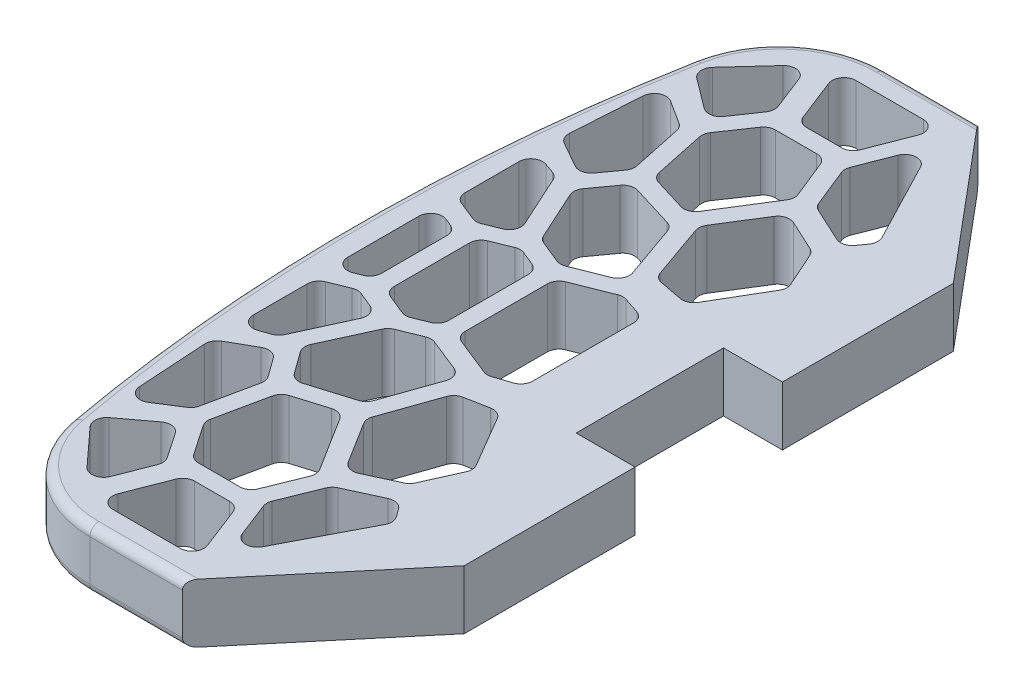
from build123d import *

# Parameters (mm, degrees)
BOSS_EXTRUDE1_DEPTH = 10
FILLET1_R           = 3


with BuildPart() as part:
    # Sketch1 → Boss-Extrude1 (new, symmetric)
    with BuildSketch(Plane(origin=(0, 0, 0), x_dir=(1, 0, 0), z_dir=(0, 1, 0))):
        with BuildLine():
            Line((0, 83), (-43.633180821, 135))
            Line((-43.633180821, 135), (-75, 135))
            ThreePointArc((-75, 135), (-98.046638388, 126.655966066), (-110.409836066, 105.491803279))
            ThreePointArc((-110.409836066, 105.491803279), (-120, 0), (-110.409836066, -105.491803279))
            ThreePointArc((-110.409836066, -105.491803279), (-98.046638388, -126.655966066), (-75, -135))
            Line((-75, -135), (-43.633180821, -135))
            Line((-43.633180821, -135), (0, -83))
            Line((0, -83), (0, -25))
            Line((0, -25), (-20, -25))
            Line((-20, -25), (-20, 25))
            Line((-20, 25), (0, 25))
            Line((0, 25), (0, 83))
        make_face()
        with BuildLine():
            Line((-51.583510871, -99.551891667), (-47.043977303, -111.24493966))
            ThreePointArc((-47.043977303, -111.24493966), (-43.53404012, -113.791310112), (-39.766825217, -111.643810779))
            Line((-39.766825217, -111.643810779), (-25.557952149, -84.3396352))
            ThreePointArc((-25.557952149, -84.3396352), (-25.116544676, -82.206333495), (-25.858537821, -80.158099404))
            Line((-25.858537821, -80.158099404), (-27.793296277, -77.467111323))
            ThreePointArc((-27.793296277, -77.467111323), (-30.01966596, -75.934731591), (-32.712336522, -76.168044361))
            Line((-32.712336522, -76.168044361), (-44.289692518, -81.492492205))
            ThreePointArc((-44.289692518, -81.492492205), (-45.513232816, -82.366202314), (-46.327796918, -83.629889594))
            Line((-46.327796918, -83.629889594), (-51.564089102, -96.607557417))
            ThreePointArc((-51.564089102, -96.607557417), (-51.854569543, -98.077872496), (-51.583510871, -99.551891667))
        make_face(mode=Mode.SUBTRACT)
        with BuildLine():
            Line((-76.169198798, -126.067380558), (-53.243197888, -126.067380558))
            ThreePointArc((-53.243197888, -126.067380558), (-49.942399661, -124.326745749), (-49.51434358, -120.619746091))
            Line((-49.51434358, -120.619746091), (-55.022930664, -106.430584985))
            ThreePointArc((-55.022930664, -106.430584985), (-56.492419781, -104.577421226), (-58.751784972, -103.878219453))
            Line((-58.751784972, -103.878219453), (-70.633478788, -103.878219453))
            ThreePointArc((-70.633478788, -103.878219453), (-72.890102388, -104.575546304), (-74.359923873, -106.424394489))
            Line((-74.359923873, -106.424394489), (-79.895643883, -120.613555595))
            ThreePointArc((-79.895643883, -120.613555595), (-79.471871946, -124.324004158), (-76.169198798, -126.067380558))
        make_face(mode=Mode.SUBTRACT)
        with BuildLine():
            Line((-104.314416206, -105.622682832), (-92.903661411, -118.071048963))
            ThreePointArc((-92.903661411, -118.071048963), (-89.219305628, -119.29994155), (-86.228570564, -116.822007268))
            Line((-86.228570564, -116.822007268), (-81.731391874, -105.294835944))
            ThreePointArc((-81.731391874, -105.294835944), (-81.483446176, -103.389106237), (-82.152909795, -101.58768978))
            Line((-82.152909795, -101.58768978), (-87.95611023, -93.07618474))
            ThreePointArc((-87.95611023, -93.07618474), (-90.607698285, -91.383223133), (-93.663418974, -92.131293511))
            Line((-93.663418974, -92.131293511), (-103.768152023, -99.721603743))
            ThreePointArc((-103.768152023, -99.721603743), (-105.348741321, -102.551111688), (-104.314416206, -105.622682832))
        make_face(mode=Mode.SUBTRACT)
        with BuildLine():
            Line((-110.409836066, -12.05611111), (-110.409836066, 12.05611111))
            ThreePointArc((-110.409836066, 12.05611111), (-108.643074701, 15.374641688), (-104.903513467, 15.76164646))
            Line((-104.903513467, 15.76164646), (-102.447325525, 14.763191161))
            ThreePointArc((-102.447325525, 14.763191161), (-100.635117546, 13.290894447), (-99.953648124, 11.057655812))
            Line((-99.953648124, 11.057655812), (-99.953648124, -11.057655812))
            ThreePointArc((-99.953648124, -11.057655812), (-100.635117546, -13.290894447), (-102.447325525, -14.763191161))
            Line((-102.447325525, -14.763191161), (-104.903513467, -15.76164646))
            ThreePointArc((-104.903513467, -15.76164646), (-108.643074701, -15.374641688), (-110.409836066, -12.05611111))
        make_face(mode=Mode.SUBTRACT)
        with BuildLine():
            Line((-91.459970723, 16.461636395), (-84.931076073, 19.115671678))
            ThreePointArc((-84.931076073, 19.115671678), (-83.424753474, 19.410136328), (-81.918430875, 19.115671678))
            Line((-81.918430875, 19.115671678), (-77.203913224, 17.199191652))
            ThreePointArc((-77.203913224, 17.199191652), (-75.391705245, 15.726894938), (-74.710235823, 13.493656303))
            Line((-74.710235823, 13.493656303), (-74.710235823, -13.493656303))
            ThreePointArc((-74.710235823, -13.493656303), (-75.391705245, -15.726894938), (-77.203913224, -17.199191652))
            Line((-77.203913224, -17.199191652), (-81.918430875, -19.115671678))
            ThreePointArc((-81.918430875, -19.115671678), (-83.424753474, -19.410136328), (-84.931076073, -19.115671678))
            Line((-84.931076073, -19.115671678), (-91.459970723, -16.461636395))
            ThreePointArc((-91.459970723, -16.461636395), (-93.272178702, -14.989339681), (-93.953648124, -12.756101046))
            Line((-93.953648124, -12.756101046), (-93.953648124, 12.756101046))
            ThreePointArc((-93.953648124, 12.756101046), (-93.272178702, 14.989339681), (-91.459970723, 16.461636395))
        make_face(mode=Mode.SUBTRACT)
        with BuildLine():
            Line((-68.710235823, -13.938814796), (-68.710235823, 13.938814796))
            ThreePointArc((-68.710235823, 13.938814796), (-68.021647467, 16.18259574), (-66.192959361, 17.653855968))
            Line((-66.192959361, 17.653855968), (-53.597435718, 22.68090103))
            ThreePointArc((-53.597435718, 22.68090103), (-52.231300048, 22.964160406), (-50.850980279, 22.760985901))
            Line((-50.850980279, 22.760985901), (-45.35232675, 20.929999578))
            ThreePointArc((-45.35232675, 20.929999578), (-43.371453313, 19.474218785), (-42.616058651, 17.134873535))
            Line((-42.616058651, 17.134873535), (-42.616058651, -17.134873535))
            ThreePointArc((-42.616058651, -17.134873535), (-43.371453313, -19.474218785), (-45.35232675, -20.929999578))
            Line((-45.35232675, -20.929999578), (-50.850980279, -22.760985901))
            ThreePointArc((-50.850980279, -22.760985901), (-52.231300048, -22.964160406), (-53.597435718, -22.68090103))
            Line((-53.597435718, -22.68090103), (-66.192959361, -17.653855968))
            ThreePointArc((-66.192959361, -17.653855968), (-68.021647467, -16.18259574), (-68.710235823, -13.938814796))
        make_face(mode=Mode.SUBTRACT)
        with BuildLine():
            Line((-109.467200853, -45.084990895), (-109.467200853, -26.785450362))
            ThreePointArc((-109.467200853, -26.785450362), (-108.785731431, -24.552211727), (-106.973523452, -23.079915013))
            Line((-106.973523452, -23.079915013), (-100.549048075, -20.468326798))
            ThreePointArc((-100.549048075, -20.468326798), (-99.042725476, -20.173862148), (-97.536402877, -20.468326798))
            Line((-97.536402877, -20.468326798), (-92.429437297, -22.544339288))
            ThreePointArc((-92.429437297, -22.544339288), (-90.218255908, -24.773336762), (-90.297464245, -27.912043328))
            Line((-90.297464245, -27.912043328), (-98.337911629, -45.511655757))
            ThreePointArc((-98.337911629, -45.511655757), (-99.275493757, -46.800105046), (-100.641672676, -47.620298304))
            Line((-100.641672676, -47.620298304), (-104.132666249, -48.855802133))
            ThreePointArc((-104.132666249, -48.855802133), (-107.776081705, -48.351345011), (-109.467200853, -45.084990895))
        make_face(mode=Mode.SUBTRACT)
        with BuildLine():
            Line((-91.028243615, -43.950602801), (-83.466307585, -27.398396567))
            ThreePointArc((-83.466307585, -27.398396567), (-82.595792825, -26.17276524), (-81.334334533, -25.355029908))
            Line((-81.334334533, -25.355029908), (-73.785358558, -22.286325378))
            ThreePointArc((-73.785358558, -22.286325378), (-72.291756772, -21.991880956), (-70.796312421, -22.276819556))
            Line((-70.796312421, -22.276819556), (-59.788001344, -26.670386462))
            ThreePointArc((-59.788001344, -26.670386462), (-57.628848621, -28.731118927), (-57.497437693, -31.71294554))
            Line((-57.497437693, -31.71294554), (-63.878784021, -49.851045401))
            ThreePointArc((-63.878784021, -49.851045401), (-64.88305062, -51.410138826), (-66.482539605, -52.348732827))
            Line((-66.482539605, -52.348732827), (-80.925996583, -56.764725681))
            ThreePointArc((-80.925996583, -56.764725681), (-83.369608001, -56.731184975), (-85.337640324, -55.282319721))
            Line((-85.337640324, -55.282319721), (-90.632060101, -47.955570863))
            ThreePointArc((-90.632060101, -47.955570863), (-91.370518919, -46.006541571), (-91.028243615, -43.950602801))
        make_face(mode=Mode.SUBTRACT)
        with BuildLine():
            Line((-109.185897217, -61.87312516), (-107.716713798, -85.45480826))
            ThreePointArc((-107.716713798, -85.45480826), (-105.538804361, -88.770929923), (-101.57603347, -88.580143981))
            Line((-101.57603347, -88.580143981), (-93.567892012, -83.480989595))
            ThreePointArc((-93.567892012, -83.480989595), (-92.427915772, -82.384305249), (-91.802216554, -80.931458777))
            Line((-91.802216554, -80.931458777), (-88.195310047, -63.809248772))
            ThreePointArc((-88.195310047, -63.809248772), (-88.196501553, -62.154552316), (-88.867294221, -60.641919189))
            Line((-88.867294221, -60.641919189), (-93.373030139, -54.406600328))
            ThreePointArc((-93.373030139, -54.406600328), (-95.765108561, -52.840762765), (-98.591441924, -53.271722356))
            Line((-98.591441924, -53.271722356), (-107.16993739, -58.146722508))
            ThreePointArc((-107.16993739, -58.146722508), (-108.711796874, -59.721098426), (-109.185897217, -61.87312516))
        make_face(mode=Mode.SUBTRACT)
        with BuildLine():
            Line((-59.251697806, -54.778040986), (-52.741129763, -36.27264616))
            ThreePointArc((-52.741129763, -36.27264616), (-51.5738241, -34.565553665), (-49.709944902, -33.669606327))
            Line((-49.709944902, -33.669606327), (-41.851396628, -32.185886366))
            ThreePointArc((-41.851396628, -32.185886366), (-39.453295699, -32.475335944), (-37.659082514, -34.092576856))
            Line((-37.659082514, -34.092576856), (-27.485532771, -51.436056894))
            ThreePointArc((-27.485532771, -51.436056894), (-26.941717734, -53.241406998), (-27.28533147, -55.095309205))
            Line((-27.28533147, -55.095309205), (-32.572892381, -66.897900524))
            ThreePointArc((-32.572892381, -66.897900524), (-33.377285177, -68.073239302), (-34.542494472, -68.892236442))
            Line((-34.542494472, -68.892236442), (-45.017913038, -73.743077262))
            ThreePointArc((-45.017913038, -73.743077262), (-47.837272018, -73.947897777), (-50.088016189, -72.237667624))
            Line((-50.088016189, -72.237667624), (-58.867702773, -58.229870235))
            ThreePointArc((-58.867702773, -58.229870235), (-59.45388757, -56.547806551), (-59.251697806, -54.778040986))
        make_face(mode=Mode.SUBTRACT)
        with BuildLine():
            Line((-86.098877878, -82.964838643), (-82.455180266, -65.66797897))
            ThreePointArc((-82.455180266, -65.66797897), (-81.492665055, -63.792848275), (-79.71061556, -62.667303851))
            Line((-79.71061556, -62.667303851), (-68.758995788, -59.318917468))
            ThreePointArc((-68.758995788, -59.318917468), (-66.191217311, -59.396469443), (-64.200172027, -61.019811457))
            Line((-64.200172027, -61.019811457), (-52.796960318, -79.213385644))
            ThreePointArc((-52.796960318, -79.213385644), (-52.201794736, -80.985423607), (-52.476819935, -82.834396769))
            Line((-52.476819935, -82.834396769), (-57.536730596, -95.374919235))
            ThreePointArc((-57.536730596, -95.374919235), (-59.008619742, -97.193849041), (-61.246163135, -97.878219453))
            Line((-61.246163135, -97.878219453), (-75.306136497, -97.878219453))
            ThreePointArc((-75.306136497, -97.878219453), (-77.175189091, -97.414692611), (-78.611063662, -96.131540654))
            Line((-78.611063662, -96.131540654), (-85.489708732, -86.042690057))
            ThreePointArc((-85.489708732, -86.042690057), (-86.108665781, -84.565985031), (-86.098877878, -82.964838643))
        make_face(mode=Mode.SUBTRACT)
        with BuildLine():
            Line((-27.793296277, 77.467111323), (-25.858537821, 80.158099404))
            ThreePointArc((-25.858537821, 80.158099404), (-25.116544676, 82.206333495), (-25.557952149, 84.3396352))
            Line((-25.557952149, 84.3396352), (-39.766825217, 111.643810779))
            ThreePointArc((-39.766825217, 111.643810779), (-43.53404012, 113.791310112), (-47.043977303, 111.24493966))
            Line((-47.043977303, 111.24493966), (-51.583510871, 99.551891667))
            ThreePointArc((-51.583510871, 99.551891667), (-51.854569543, 98.077872496), (-51.564089102, 96.607557417))
            Line((-51.564089102, 96.607557417), (-46.327796918, 83.629889594))
            ThreePointArc((-46.327796918, 83.629889594), (-45.513232816, 82.366202314), (-44.289692518, 81.492492205))
            Line((-44.289692518, 81.492492205), (-32.712336522, 76.168044361))
            ThreePointArc((-32.712336522, 76.168044361), (-30.01966596, 75.934731591), (-27.793296277, 77.467111323))
        make_face(mode=Mode.SUBTRACT)
        with BuildLine():
            Line((-78.611063662, 96.131540654), (-85.489708732, 86.042690057))
            ThreePointArc((-85.489708732, 86.042690057), (-86.108665781, 84.565985031), (-86.098877878, 82.964838643))
            Line((-86.098877878, 82.964838643), (-82.455180266, 65.66797897))
            ThreePointArc((-82.455180266, 65.66797897), (-81.492665055, 63.792848275), (-79.71061556, 62.667303851))
            Line((-79.71061556, 62.667303851), (-68.758995788, 59.318917468))
            ThreePointArc((-68.758995788, 59.318917468), (-66.191217311, 59.396469443), (-64.200172027, 61.019811457))
            Line((-64.200172027, 61.019811457), (-52.796960318, 79.213385644))
            ThreePointArc((-52.796960318, 79.213385644), (-52.201794736, 80.985423607), (-52.476819935, 82.834396769))
            Line((-52.476819935, 82.834396769), (-57.536730596, 95.374919235))
            ThreePointArc((-57.536730596, 95.374919235), (-59.008619742, 97.193849041), (-61.246163135, 97.878219453))
            Line((-61.246163135, 97.878219453), (-75.306136497, 97.878219453))
            ThreePointArc((-75.306136497, 97.878219453), (-77.175189091, 97.414692611), (-78.611063662, 96.131540654))
        make_face(mode=Mode.SUBTRACT)
        with BuildLine():
            Line((-50.088016189, 72.237667624), (-58.867702773, 58.229870235))
            ThreePointArc((-58.867702773, 58.229870235), (-59.45388757, 56.547806551), (-59.251697806, 54.778040986))
            Line((-59.251697806, 54.778040986), (-52.741129763, 36.27264616))
            ThreePointArc((-52.741129763, 36.27264616), (-51.5738241, 34.565553665), (-49.709944902, 33.669606327))
            Line((-49.709944902, 33.669606327), (-41.851396628, 32.185886366))
            ThreePointArc((-41.851396628, 32.185886366), (-39.453295699, 32.475335944), (-37.659082514, 34.092576856))
            Line((-37.659082514, 34.092576856), (-27.485532771, 51.436056894))
            ThreePointArc((-27.485532771, 51.436056894), (-26.941717734, 53.241406998), (-27.28533147, 55.095309205))
            Line((-27.28533147, 55.095309205), (-32.572892381, 66.897900524))
            ThreePointArc((-32.572892381, 66.897900524), (-33.377285177, 68.073239302), (-34.542494472, 68.892236442))
            Line((-34.542494472, 68.892236442), (-45.017913038, 73.743077262))
            ThreePointArc((-45.017913038, 73.743077262), (-47.837272018, 73.947897777), (-50.088016189, 72.237667624))
        make_face(mode=Mode.SUBTRACT)
        with BuildLine():
            Line((-98.591441924, 53.271722356), (-107.16993739, 58.146722508))
            ThreePointArc((-107.16993739, 58.146722508), (-108.711796874, 59.721098426), (-109.185897217, 61.87312516))
            Line((-109.185897217, 61.87312516), (-107.716713798, 85.45480826))
            ThreePointArc((-107.716713798, 85.45480826), (-105.538804361, 88.770929923), (-101.57603347, 88.580143981))
            Line((-101.57603347, 88.580143981), (-93.567892012, 83.480989595))
            ThreePointArc((-93.567892012, 83.480989595), (-92.427915772, 82.384305249), (-91.802216554, 80.931458777))
            Line((-91.802216554, 80.931458777), (-88.195310047, 63.809248772))
            ThreePointArc((-88.195310047, 63.809248772), (-88.196501553, 62.154552316), (-88.867294221, 60.641919189))
            Line((-88.867294221, 60.641919189), (-93.373030139, 54.406600328))
            ThreePointArc((-93.373030139, 54.406600328), (-95.765108561, 52.840762765), (-98.591441924, 53.271722356))
        make_face(mode=Mode.SUBTRACT)
        with BuildLine():
            Line((-85.337640324, 55.282319721), (-90.632060101, 47.955570863))
            ThreePointArc((-90.632060101, 47.955570863), (-91.370518919, 46.006541571), (-91.028243615, 43.950602801))
            Line((-91.028243615, 43.950602801), (-83.466307585, 27.398396567))
            ThreePointArc((-83.466307585, 27.398396567), (-82.595792825, 26.17276524), (-81.334334533, 25.355029908))
            Line((-81.334334533, 25.355029908), (-73.785358558, 22.286325378))
            ThreePointArc((-73.785358558, 22.286325378), (-72.291756772, 21.991880956), (-70.796312421, 22.276819556))
            Line((-70.796312421, 22.276819556), (-59.788001344, 26.670386462))
            ThreePointArc((-59.788001344, 26.670386462), (-57.628848621, 28.731118927), (-57.497437693, 31.71294554))
            Line((-57.497437693, 31.71294554), (-63.878784021, 49.851045401))
            ThreePointArc((-63.878784021, 49.851045401), (-64.88305062, 51.410138826), (-66.482539605, 52.348732827))
            Line((-66.482539605, 52.348732827), (-80.925996583, 56.764725681))
            ThreePointArc((-80.925996583, 56.764725681), (-83.369608001, 56.731184975), (-85.337640324, 55.282319721))
        make_face(mode=Mode.SUBTRACT)
        with BuildLine():
            Line((-100.641672676, 47.620298304), (-104.132666249, 48.855802133))
            ThreePointArc((-104.132666249, 48.855802133), (-107.776081705, 48.351345011), (-109.467200853, 45.084990895))
            Line((-109.467200853, 45.084990895), (-109.467200853, 26.785450362))
            ThreePointArc((-109.467200853, 26.785450362), (-108.785731431, 24.552211727), (-106.973523452, 23.079915013))
            Line((-106.973523452, 23.079915013), (-100.549048075, 20.468326798))
            ThreePointArc((-100.549048075, 20.468326798), (-99.042725476, 20.173862148), (-97.536402877, 20.468326798))
            Line((-97.536402877, 20.468326798), (-92.429437297, 22.544339288))
            ThreePointArc((-92.429437297, 22.544339288), (-90.218255908, 24.773336762), (-90.297464245, 27.912043328))
            Line((-90.297464245, 27.912043328), (-98.337911629, 45.511655757))
            ThreePointArc((-98.337911629, 45.511655757), (-99.275493757, 46.800105046), (-100.641672676, 47.620298304))
        make_face(mode=Mode.SUBTRACT)
        with BuildLine():
            Line((-93.663418974, 92.131293511), (-103.768152023, 99.721603743))
            ThreePointArc((-103.768152023, 99.721603743), (-105.348741321, 102.551111688), (-104.314416206, 105.622682832))
            Line((-104.314416206, 105.622682832), (-92.903661411, 118.071048963))
            ThreePointArc((-92.903661411, 118.071048963), (-89.219305628, 119.29994155), (-86.228570564, 116.822007268))
            Line((-86.228570564, 116.822007268), (-81.731391874, 105.294835944))
            ThreePointArc((-81.731391874, 105.294835944), (-81.483446176, 103.389106237), (-82.152909795, 101.58768978))
            Line((-82.152909795, 101.58768978), (-87.95611023, 93.07618474))
            ThreePointArc((-87.95611023, 93.07618474), (-90.607698285, 91.383223133), (-93.663418974, 92.131293511))
        make_face(mode=Mode.SUBTRACT)
        with BuildLine():
            Line((-74.359923873, 106.424394489), (-79.895643883, 120.613555595))
            ThreePointArc((-79.895643883, 120.613555595), (-79.471871946, 124.324004158), (-76.169198798, 126.067380558))
            Line((-76.169198798, 126.067380558), (-53.243197888, 126.067380558))
            ThreePointArc((-53.243197888, 126.067380558), (-49.942399661, 124.326745749), (-49.51434358, 120.619746091))
            Line((-49.51434358, 120.619746091), (-55.022930664, 106.430584985))
            ThreePointArc((-55.022930664, 106.430584985), (-56.492419781, 104.577421226), (-58.751784972, 103.878219453))
            Line((-58.751784972, 103.878219453), (-70.633478788, 103.878219453))
            ThreePointArc((-70.633478788, 103.878219453), (-72.890102388, 104.575546304), (-74.359923873, 106.424394489))
        make_face(mode=Mode.SUBTRACT)
    extrude(amount=BOSS_EXTRUDE1_DEPTH, both=True)

    # Fillet1
    fillet1_edges = [part.edges().sort_by_distance(p)[0] for p in [
        (-120, -10, 0),
        (-98.046638388, -10, -126.655966066),
        (-59.316590411, -10, -135),
        (-59.316590411, -10, 135),
        (-98.046638388, -10, 126.655966066),
        (-98.046638388, 10, 126.655966066),
        (-59.316590411, 10, 135),
        (-59.316590411, 10, -135),
        (-98.046638388, 10, -126.655966066),
        (-120, 10, 0),
    ]]
    fillet(fillet1_edges, radius=FILLET1_R)


solid = part.part
